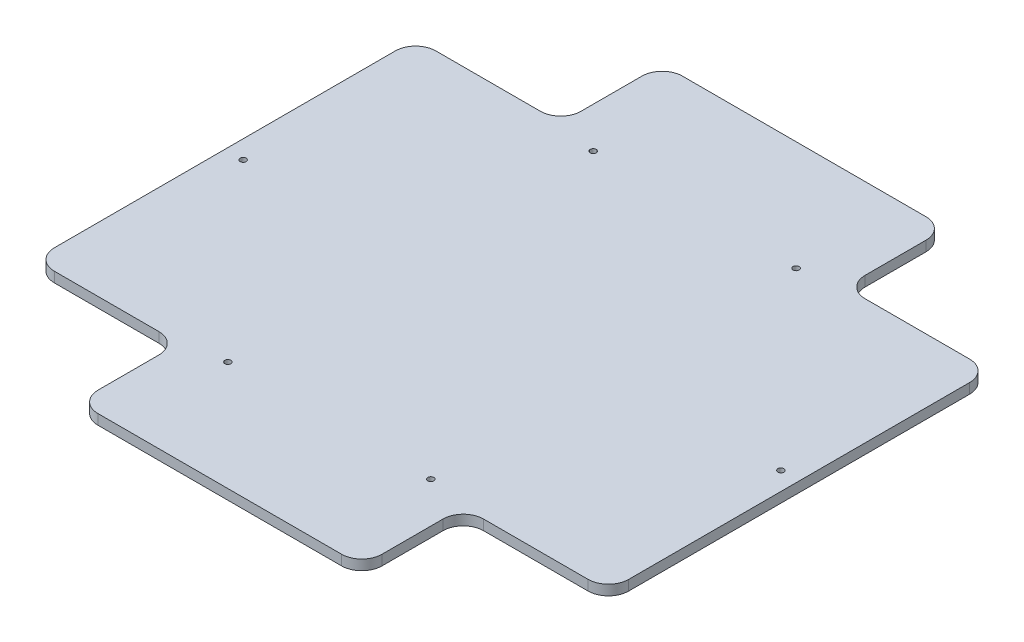
from build123d import *

# Parameters (mm, degrees)
SKETCH_1_W           = 300
SKETCH_1_H           = 300
EXTRUDE_1_DEPTH      = 5
CUT_EXTRUDE_3_DEPTH  = 10
CUT_EXTRUDE_5_DEPTH  = 10
SKETCH_7_OUTSIDE_W   = 373.028
SKETCH_7_OUTSIDE_H   = 263.028
SKETCH_7_OUTSIDE_W_2 = 283
SKETCH_7_OUTSIDE_H_2 = 188
CUT_EXTRUDE_6_DEPTH  = 10
FILLET_1_R           = 10
SKETCH_8_R           = 1.5
CUT_EXTRUDE_7_DEPTH  = 200
SKETCH_9_R           = 1.5
CUT_EXTRUDE_8_DEPTH  = 200
SKETCH_10_W          = 140
SKETCH_10_H          = 50
EXTRUDE_2_DEPTH      = 5
FILLET_2_R           = 10


with BuildPart() as part:
    # 草图1 → 凸台-拉伸1 (new body)
    with BuildSketch(Plane(origin=(0, 0, 0), x_dir=(1, 0, 0), z_dir=(0, 1, 0))):
        Rectangle(SKETCH_1_W, SKETCH_1_H)
    extrude(amount=EXTRUDE_1_DEPTH)

    # 草图4 → 切除-拉伸3 (cut)
    with BuildSketch(Plane(origin=(0, 5, 0), x_dir=(1, 0, 0), z_dir=(0, 1, 0))):
        Polygon((-88.251311829, 95), (84.324863402, 95), (73.252498177, 170.696662895), (-48.543519298, 170.696662895), align=None)
        Polygon((-81.835862219, -95), (-68.397415564, -170.764406983), (34.942066678, -175.273207327), (78.78868079, -129.283443823), (78.78868079, -95), align=None)
    extrude(amount=-CUT_EXTRUDE_3_DEPTH, mode=Mode.SUBTRACT)

    # 草图6 → 切除-拉伸5 (cut)
    with BuildSketch(Plane(origin=(0, 5, 0), x_dir=(1, 0, 0), z_dir=(0, 1, 0))):
        Polygon((-88.251311829, 95), (233.509150227, 95), (223.865704495, 204.923221807), (-177.714928491, 215.944302643), (-226.620974704, 137.419101682), (-226.620974704, 114.688122456), (-226.620974704, 95), align=None)
        Polygon((-81.835862219, -95), (223.865704495, -95), (223.865704495, -205.612039359), (-238.330873093, -205.612039359), (-238.330873093, -95), align=None)
    extrude(amount=-CUT_EXTRUDE_5_DEPTH, mode=Mode.SUBTRACT)

    # 草图7 outside → 切除-拉伸6 (cut)
    with BuildSketch(Plane(origin=(0, 5, 0), x_dir=(1, 0, 0), z_dir=(0, 1, 0))):
        Rectangle(SKETCH_7_OUTSIDE_W, SKETCH_7_OUTSIDE_H)
        Rectangle(SKETCH_7_OUTSIDE_W_2, SKETCH_7_OUTSIDE_H_2, mode=Mode.SUBTRACT)
    extrude(amount=-CUT_EXTRUDE_6_DEPTH, mode=Mode.SUBTRACT)

    # 圆角1
    fillet_1_edges = [part.edges().sort_by_distance(p)[0] for p in [
        (-141.5, 2.5, -94),
        (141.5, 2.5, -94),
        (141.5, 2.5, 94),
        (-141.5, 2.5, 94),
    ]]
    fillet(fillet_1_edges, radius=FILLET_1_R)

    # 草图8 → 切除-拉伸7 (cut)
    with BuildSketch(Plane(origin=(0, 5, 0), x_dir=(1, 0, 0), z_dir=(0, 1, 0))):
        with Locations(Location((-132.5, 0, 0), (0, 0, 270))):
            Circle(SKETCH_8_R)
        with Locations(Location((132.5, 0, 0), (0, 0, 270))):
            Circle(SKETCH_8_R)
    extrude(amount=-CUT_EXTRUDE_7_DEPTH, mode=Mode.SUBTRACT)

    # 草图9 → 切除-拉伸8 (cut)
    with BuildSketch(Plane(origin=(0, 5, 0), x_dir=(1, 0, 0), z_dir=(0, 1, 0))):
        with Locations(Location((-50, 90, 0), (0, 0, 270))):
            Circle(SKETCH_9_R)
        with Locations(Location((50, 90, 0), (0, 0, 270))):
            Circle(SKETCH_9_R)
    cut_extrude_8 = extrude(amount=-CUT_EXTRUDE_8_DEPTH, mode=Mode.SUBTRACT)

    # 镜向1: 切除-拉伸8 across plane
    add(cut_extrude_8.mirror(Plane.XY), mode=Mode.SUBTRACT)

    # 草图10 → 凸台-拉伸2 (add)
    with BuildSketch(Plane(origin=(0, 5, 0), x_dir=(1, 0, 0), z_dir=(0, 1, 0))):
        with Locations((0, -119)):
            Rectangle(SKETCH_10_W, SKETCH_10_H)
        with Locations((0, 119)):
            Rectangle(SKETCH_10_W, SKETCH_10_H)
    extrude(amount=-EXTRUDE_2_DEPTH)

    # 圆角2
    fillet_2_edges = [part.edges().sort_by_distance(p)[0] for p in [
        (-70, 2.5, 144),
        (-70, 2.5, 94),
        (70, 2.5, 94),
        (70, 2.5, 144),
        (70, 2.5, -94),
        (-70, 2.5, -94),
        (-70, 2.5, -144),
        (70, 2.5, -144),
    ]]
    fillet(fillet_2_edges, radius=FILLET_2_R)


solid = part.part
